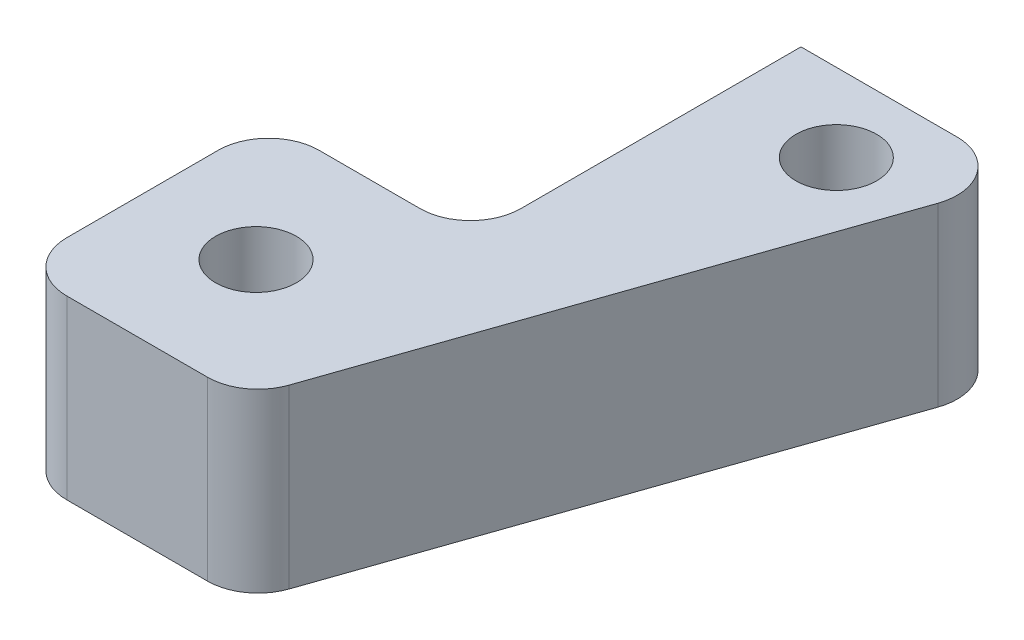
from build123d import *

# Parameters (mm, degrees)
SKETCH2_R           = 1.6
BOSS_EXTRUDE1_DEPTH = 7
FILLET1_R           = 2
FILLET2_R           = 2


with BuildPart() as part:
    # Sketch2 → Boss-Extrude1 (new body)
    with BuildSketch(Plane(origin=(0, -35.748750458, 0), x_dir=(1, 0, 0), z_dir=(0, 1, 0))):
        Polygon((-41.703283355, -38.480035415), (-41.703283355, -48.480035415), (-32.703283355, -48.480035415), (-24.703283355, -25.380229921), (-33.703283355, -25.380229921), (-33.703283355, -38.480035415), (-40.703283355, -38.480035415), align=None)
        with Locations(Location((-37.203283355, -43.480035415, 0), (0, 0, 270))):
            Circle(SKETCH2_R, mode=Mode.SUBTRACT)
        with Locations(Location((-29.203283355, -28.480035415, 0), (0, 0, 270))):
            Circle(SKETCH2_R, mode=Mode.SUBTRACT)
    extrude(amount=BOSS_EXTRUDE1_DEPTH)

    # Fillet1
    fillet1_edges = [part.edges().sort_by_distance(p)[0] for p in [
        (-24.703283355, -32.248750458, 25.380229921),
    ]]
    fillet(fillet1_edges, radius=FILLET1_R)

    # Fillet2
    fillet2_edges = [part.edges().sort_by_distance(p)[0] for p in [
        (-32.703283355, -32.248750458, 48.480035415),
        (-41.703283355, -32.248750458, 48.480035415),
        (-41.703283355, -32.248750458, 38.480035415),
        (-33.703283355, -32.248750458, 38.480035415),
    ]]
    fillet(fillet2_edges, radius=FILLET2_R)


solid = part.part
